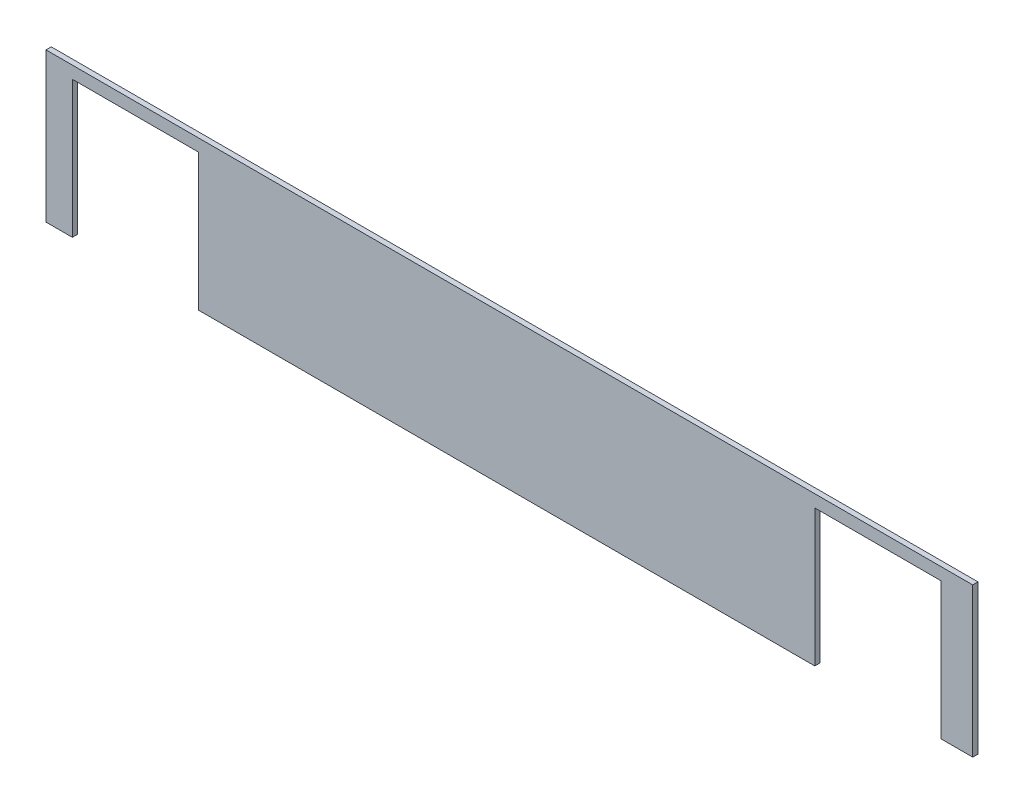
from build123d import *

# Parameters (mm, degrees)
SKETCH2_W           = 13411.2
SKETCH2_H           = 2159
BOSS_EXTRUDE1_DEPTH = 76.2
SKETCH3_W           = 1828.8
SKETCH3_H           = 1981.2
CUT_EXTRUDE1_DEPTH  = 13585.085279473


with BuildPart() as part:
    # Sketch2 → Boss-Extrude1 (new body)
    with BuildSketch(Plane.XY):
        with Locations((6705.6, 1079.5)):
            Rectangle(SKETCH2_W, SKETCH2_H)
    extrude(amount=BOSS_EXTRUDE1_DEPTH)

    # Sketch3 → Cut-Extrude1 (cut, through all)
    with BuildSketch(Plane(origin=(0, 0, 0), x_dir=(-1, 0, 0), z_dir=(0, 0, -1))):
        with Locations((-12039.6, 990.6)):
            Rectangle(SKETCH3_W, SKETCH3_H)
        with Locations((-1295.4, 990.6)):
            Rectangle(SKETCH3_W, SKETCH3_H)
    extrude(amount=-CUT_EXTRUDE1_DEPTH, mode=Mode.SUBTRACT)


solid = part.part
